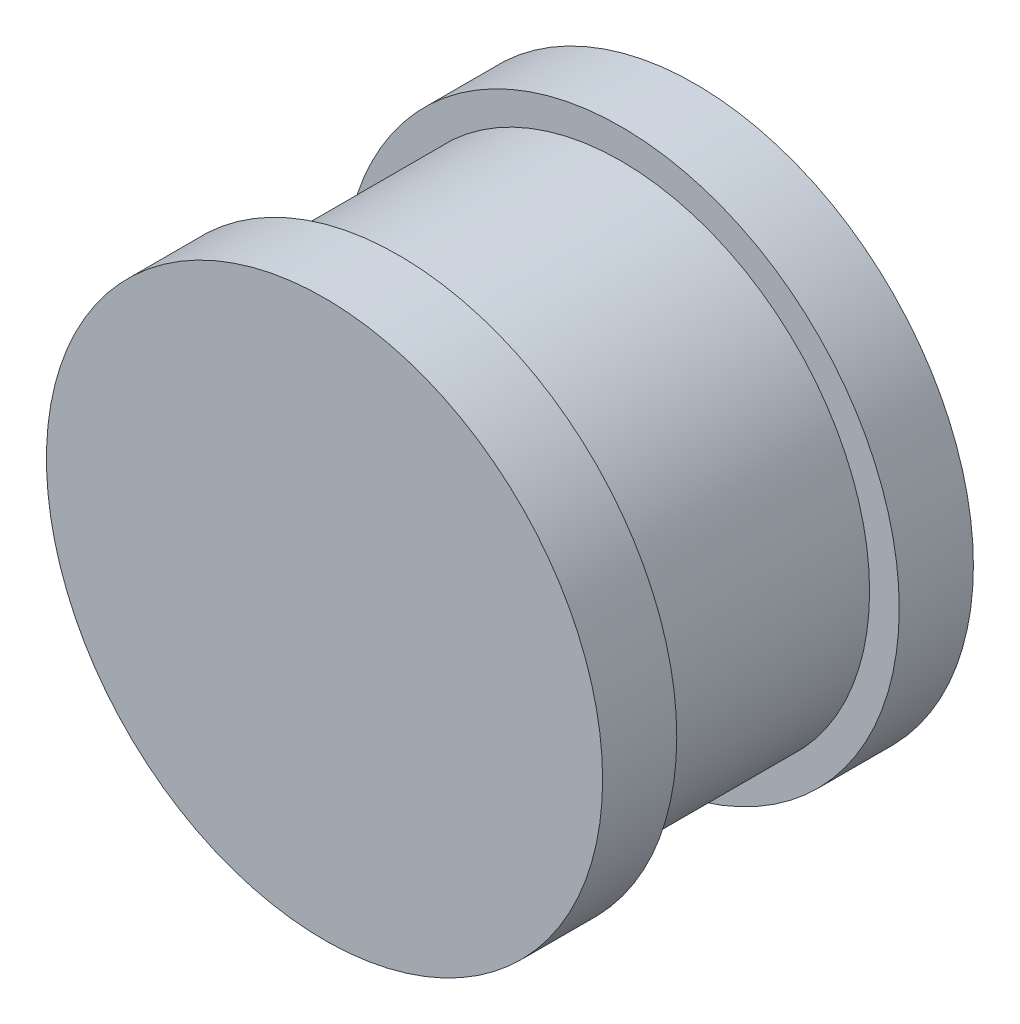
from build123d import *


with BuildPart() as part:
    # Sketch1 → Revolve1 (revolve)
    with BuildSketch(Plane(origin=(0, 0, 0), x_dir=(1, 0, 0), z_dir=(0, 1, 0))):
        Polygon((0, 0), (3.75, 0), (3.75, -1), (3.35, -1), (3.35, -4), (3.75, -4), (3.75, -5), (0, -5), align=None)
    revolve(axis=Axis((0, 0, 5), (0, 0, -1)))


solid = part.part
